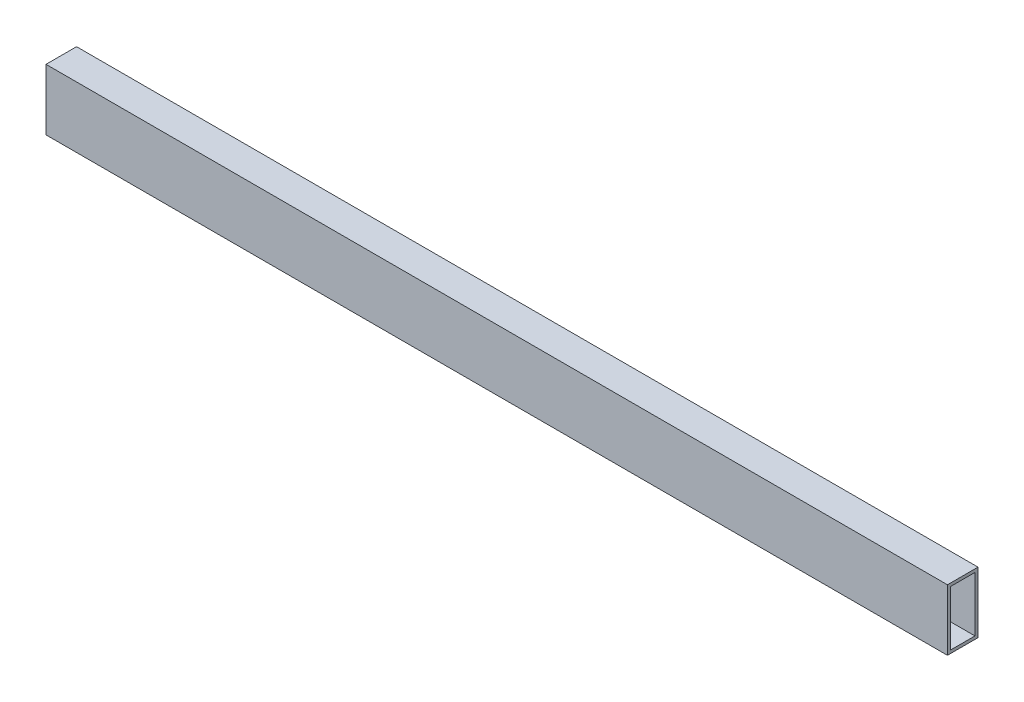
from build123d import *

# Parameters (mm, degrees)
ESBO_O2_W   = 20
ESBO_O2_H   = 40
ESBO_O2_W_2 = 16
ESBO_O2_H_2 = 36


with BuildPart() as part:
    # Varredura1: sweep along a path in Esboço1
    with BuildLine(Plane(origin=(0, 0, 0), x_dir=(1, 0, 0), z_dir=(0, 1, 0))) as varredura1_path:
        Line((0, 0), (590, 0))
    # Esboço2 → Varredura1 (sweep)
    with BuildSketch(Plane(origin=(0, 0, 0), x_dir=(0, 0, -1), z_dir=(1, 0, 0))):
        Rectangle(ESBO_O2_W, ESBO_O2_H)
        Rectangle(ESBO_O2_W_2, ESBO_O2_H_2, mode=Mode.SUBTRACT)
    sweep(path=varredura1_path.line)


solid = part.part
